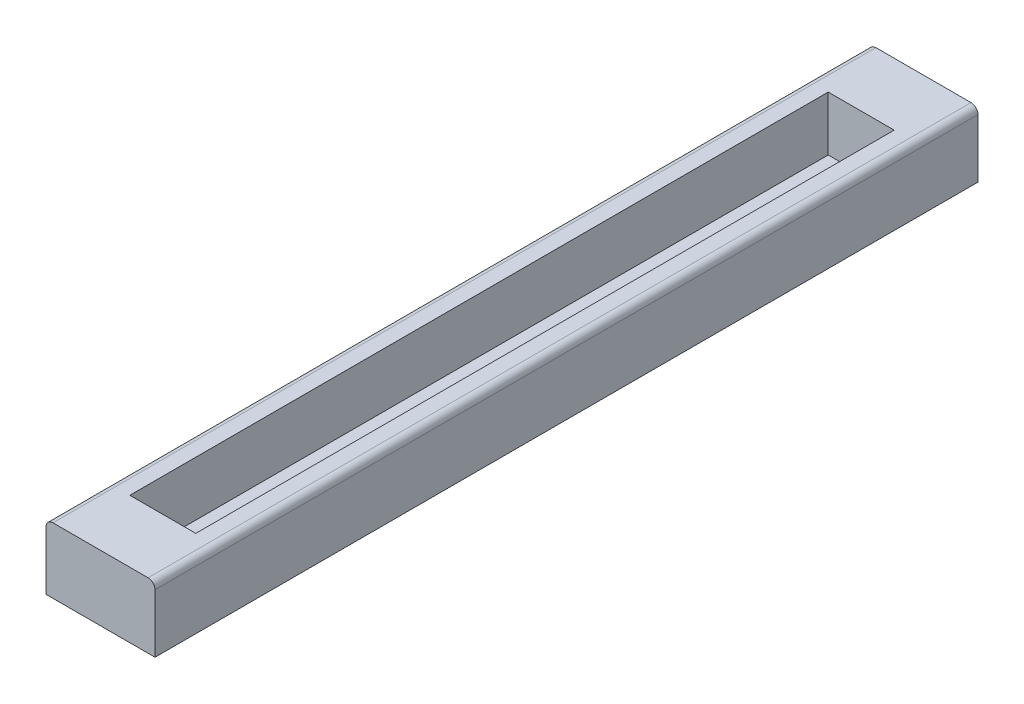
from build123d import *

# Parameters (mm, degrees)
SKETCH1_W           = 2
SKETCH1_H           = 15.1
BOSS_EXTRUDE1_DEPTH = 1.2
SKETCH2_W           = 1.21
SKETCH2_H           = 12.814
CUT_EXTRUDE1_DEPTH  = 1
FILLET1_R           = 0.127


with BuildPart() as part:
    # Sketch1 → Boss-Extrude1 (new body)
    with BuildSketch(Plane(origin=(0, 1.2, 0), x_dir=(-1, 0, 0), z_dir=(0, 1, 0))):
        Rectangle(SKETCH1_W, SKETCH1_H)
    extrude(amount=-BOSS_EXTRUDE1_DEPTH)

    # Sketch2 → Cut-Extrude1 (cut)
    with BuildSketch(Plane(origin=(0, 1.2, 0), x_dir=(-1, 0, 0), z_dir=(0, 1, 0))):
        Rectangle(SKETCH2_W, SKETCH2_H)
    extrude(amount=-CUT_EXTRUDE1_DEPTH, mode=Mode.SUBTRACT)

    # Fillet1
    fillet1_edges = [part.edges().sort_by_distance(p)[0] for p in [
        (-1, 1.2, 0),
        (1, 1.2, 0),
    ]]
    fillet(fillet1_edges, radius=FILLET1_R)


solid = part.part
